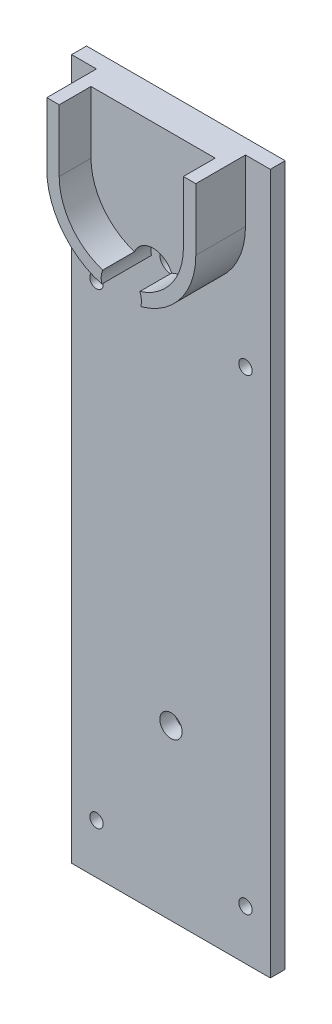
from build123d import *

# Parameters (mm, degrees)
SCHIZZO1_W                   = 40
SCHIZZO1_H                   = 141
SCHIZZO1_R                   = 2.25
ESTRUSIONE_ESTRUSIONE4_DEPTH = 3
ESTRUSIONE_ESTRUSIONE5_DEPTH = 10
ESTRUSIONE_ESTRUSIONE6_DEPTH = 3.6
FORO_PER_VITE_M2_5_1_D       = 2.7


with BuildPart() as part:
    # Schizzo1 → Estrusione-Estrusione4 (new body)
    with BuildSketch(Plane.XY):
        Rectangle(SCHIZZO1_W, SCHIZZO1_H)
        with Locations((0, 44.5)):
            Circle(SCHIZZO1_R, mode=Mode.SUBTRACT)
        with Locations((0, -36.5)):
            Circle(SCHIZZO1_R, mode=Mode.SUBTRACT)
    extrude(amount=ESTRUSIONE_ESTRUSIONE4_DEPTH)

    # Schizzo2 → Estrusione-Estrusione5 (add)
    with BuildSketch(Plane.XY.offset(3)):
        with BuildLine():
            Line((15, 58), (15, 70.5))
            Line((15, 70.5), (12.5, 70.5))
            Line((12.5, 70.5), (12.5, 58))
            ThreePointArc((12.5, 58), (10.072584945, 50.597768409), (3.733114796, 46.070462963))
            ThreePointArc((3.733114796, 46.070462963), (4.03786402, 44.813295631), (3.930680514, 43.524166667))
            ThreePointArc((3.930680514, 43.524166667), (11.915540435, 48.888474544), (15, 58))
        make_face()
        with BuildLine():
            Line((-12.5, 58), (-12.5, 70.5))
            Line((-12.5, 70.5), (-15, 70.5))
            Line((-15, 70.5), (-15, 58))
            ThreePointArc((-15, 58), (-11.915540435, 48.888474544), (-3.930680514, 43.524166667))
            ThreePointArc((-3.930680514, 43.524166667), (-4.03786402, 44.813295631), (-3.733114796, 46.070462963))
            ThreePointArc((-3.733114796, 46.070462963), (-10.072584945, 50.597768409), (-12.5, 58))
        make_face()
    extrude(amount=ESTRUSIONE_ESTRUSIONE5_DEPTH)

    # Schizzo3 → Estrusione-Estrusione6 (add)
    with BuildSketch(Plane.XY.offset(3)):
        with BuildLine():
            Line((12.5, 58), (12.5, 70.5))
            Line((12.5, 70.5), (-12.5, 70.5))
            Line((-12.5, 70.5), (-12.5, 58))
            ThreePointArc((-12.5, 58), (-10.072584945, 50.597768409), (-3.733114796, 46.070462963))
            ThreePointArc((-3.733114796, 46.070462963), (0, 48.55), (3.733114796, 46.070462963))
            ThreePointArc((3.733114796, 46.070462963), (10.072584945, 50.597768409), (12.5, 58))
        make_face()
    extrude(amount=ESTRUSIONE_ESTRUSIONE6_DEPTH)

    # Foro per Vite M2.5-1 (through all)
    with Locations(Plane(origin=(-15, 33.524166667, 3), x_dir=(1, 0, 0), z_dir=(0, 0, 1))):
        with Locations((0, 0), (0, -94.024166667)):
            foro_per_vite_m2_5_1 = Hole(FORO_PER_VITE_M2_5_1_D / 2)

    # Specchia1: Foro per Vite M2.5-1 across plane
    add(foro_per_vite_m2_5_1.mirror(Plane(origin=(0, 0, 0), x_dir=(0, 0, 1), z_dir=(1, 0, 0))), mode=Mode.SUBTRACT)


solid = part.part
